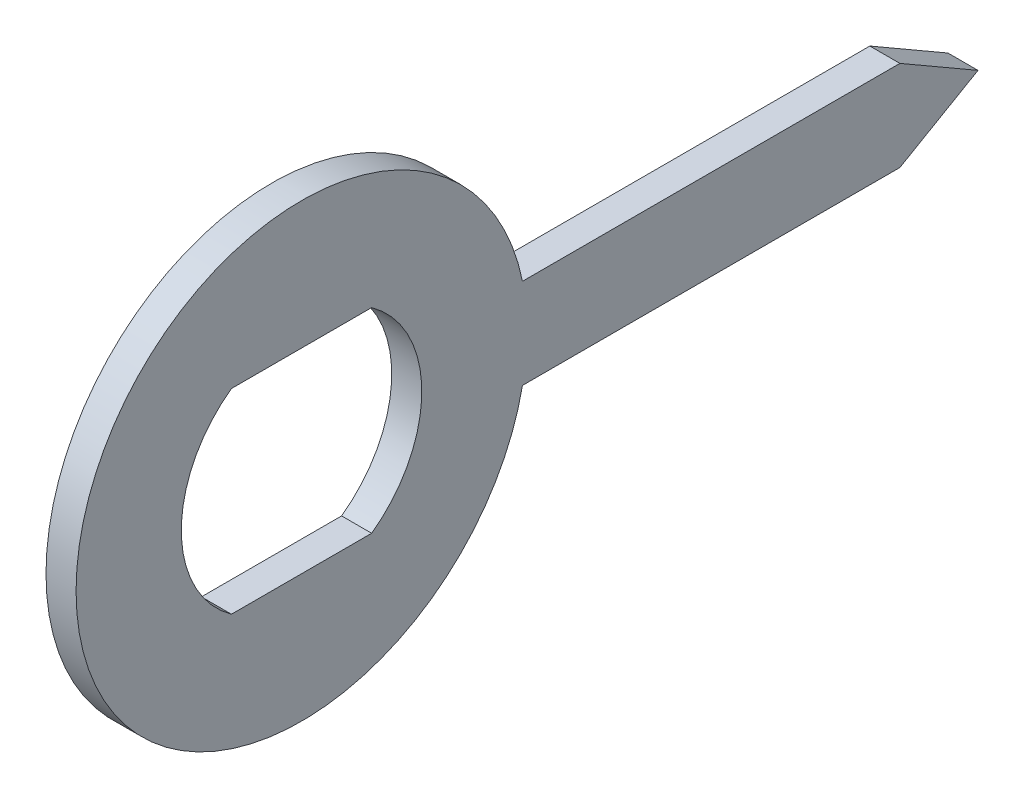
from build123d import *

# Parameters (mm, degrees)
BOSS_EXTRU_1_DEPTH = 2


with BuildPart() as part:
    # Esquisse1 → Boss.-Extru.1 (new body)
    with BuildSketch(Plane(origin=(0, 0, 0), x_dir=(0, 0, -1), z_dir=(1, 0, 0))):
        with BuildLine():
            Line((14.696938457, 3), (39.803847577, 3))
            Line((39.803847577, 3), (45, 0))
            Line((45, 0), (39.803847577, -3))
            Line((39.803847577, -3), (14.696938457, -3))
            ThreePointArc((14.696938457, -3), (-15, 0), (14.696938457, 3))
        make_face()
        with BuildLine():
            Line((-4.663689527, -6.5), (4.663689527, -6.5))
            ThreePointArc((4.663689527, -6.5), (8, 0), (4.663689527, 6.5))
            Line((4.663689527, 6.5), (-4.663689527, 6.5))
            ThreePointArc((-4.663689527, 6.5), (-8, 0), (-4.663689527, -6.5))
        make_face(mode=Mode.SUBTRACT)
    extrude(amount=BOSS_EXTRU_1_DEPTH)


solid = part.part
